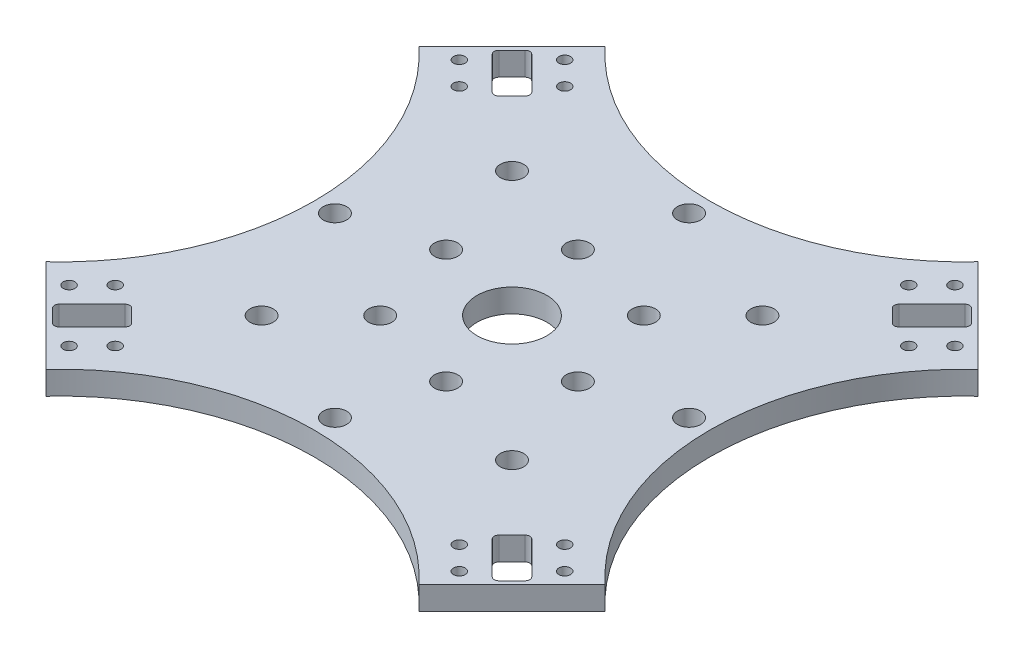
from build123d import *

# Parameters (mm, degrees)
BOSS_EXTRUDE1_DEPTH = 5
SKETCH7_R           = 1.25
CUT_EXTRUDE5_DEPTH  = 5
SKETCH9_R           = 7.5
SKETCH9_R_2         = 2.5
CUT_EXTRUDE11_DEPTH = 5


with BuildPart() as part:
    # Sketch3 → Boss-Extrude1 (new body)
    with BuildSketch(Plane(origin=(0, 0, 0), x_dir=(1, 0, 0), z_dir=(0, 1, 0))):
        with BuildLine():
            Line((-60, 40), (-40, 60))
            ThreePointArc((-40, 60), (0, 42.5), (40, 60))
            Line((40, 60), (60, 40))
            ThreePointArc((60, 40), (42.5, 0), (60, -40))
            Line((60, -40), (40, -60))
            ThreePointArc((40, -60), (0, -42.5), (-40, -60))
            Line((-40, -60), (-60, -40))
            ThreePointArc((-60, -40), (-42.5, 0), (-60, 40))
        make_face()
    extrude(amount=BOSS_EXTRUDE1_DEPTH)

    # Sketch7 → Cut-Extrude5 (cut)
    with BuildSketch(Plane(origin=(0, 5, 0), x_dir=(1, 0, 0), z_dir=(0, 1, 0))):
        with BuildLine():
            Line((-47.878679656, 50.707106781), (-49.292893219, 49.292893219))
            Line((-49.292893219, 49.292893219), (-40.807611845, 40.807611845))
            Line((-40.807611845, 40.807611845), (-39.393398282, 42.221825407))
            ThreePointArc((-39.393398282, 42.221825407), (-39.100505063, 42.928932188), (-39.393398282, 43.636038969))
            Line((-39.393398282, 43.636038969), (-46.464466094, 50.707106781))
            ThreePointArc((-46.464466094, 50.707106781), (-47.171572875, 51), (-47.878679656, 50.707106781))
        make_face()
        with BuildLine():
            Line((-40.807611845, 40.807611845), (-49.292893219, 49.292893219))
            Line((-49.292893219, 49.292893219), (-50.707106781, 47.878679656))
            ThreePointArc((-50.707106781, 47.878679656), (-51, 47.171572875), (-50.707106781, 46.464466094))
            Line((-50.707106781, 46.464466094), (-43.636038969, 39.393398282))
            ThreePointArc((-43.636038969, 39.393398282), (-42.928932188, 39.100505063), (-42.221825407, 39.393398282))
            Line((-42.221825407, 39.393398282), (-40.807611845, 40.807611845))
        make_face()
        with Locations(Location((-53.181980515, 41.868272016, 0), (0, 0, 270))):
            Circle(SKETCH7_R)
        with Locations(Location((-48.232233047, 36.918524548, 0), (0, 0, 270))):
            Circle(SKETCH7_R)
        with Locations(Location((-41.868272016, 53.181980515, 0), (0, 0, 270))):
            Circle(SKETCH7_R)
        with Locations(Location((-36.918524548, 48.232233047, 0), (0, 0, 270))):
            Circle(SKETCH7_R)
        with BuildLine():
            Line((-39.393398282, -42.221825407), (-40.807611845, -40.807611845))
            Line((-40.807611845, -40.807611845), (-49.292893219, -49.292893219))
            Line((-49.292893219, -49.292893219), (-47.878679656, -50.707106781))
            ThreePointArc((-47.878679656, -50.707106781), (-47.171572875, -51), (-46.464466094, -50.707106781))
            Line((-46.464466094, -50.707106781), (-39.393398282, -43.636038969))
            ThreePointArc((-39.393398282, -43.636038969), (-39.100505063, -42.928932188), (-39.393398282, -42.221825407))
        make_face()
        with BuildLine():
            Line((-49.292893219, -49.292893219), (-40.807611845, -40.807611845))
            Line((-40.807611845, -40.807611845), (-42.221825407, -39.393398282))
            ThreePointArc((-42.221825407, -39.393398282), (-42.928932188, -39.100505063), (-43.636038969, -39.393398282))
            Line((-43.636038969, -39.393398282), (-50.707106781, -46.464466094))
            ThreePointArc((-50.707106781, -46.464466094), (-51, -47.171572875), (-50.707106781, -47.878679656))
            Line((-50.707106781, -47.878679656), (-49.292893219, -49.292893219))
        make_face()
        with Locations(Location((-53.181980515, -41.868272016, 0), (0, 0, 270))):
            Circle(SKETCH7_R)
        with Locations(Location((-48.232233047, -36.918524548, 0), (0, 0, 270))):
            Circle(SKETCH7_R)
        with Locations(Location((-41.868272016, -53.181980515, 0), (0, 0, 270))):
            Circle(SKETCH7_R)
        with BuildLine():
            Line((49.292893219, -49.292893219), (40.807611845, -40.807611845))
            Line((40.807611845, -40.807611845), (39.393398282, -42.221825407))
            ThreePointArc((39.393398282, -42.221825407), (39.100505063, -42.928932188), (39.393398282, -43.636038969))
            Line((39.393398282, -43.636038969), (46.464466094, -50.707106781))
            ThreePointArc((46.464466094, -50.707106781), (47.171572875, -51), (47.878679656, -50.707106781))
            Line((47.878679656, -50.707106781), (49.292893219, -49.292893219))
        make_face()
        with BuildLine():
            Line((42.221825407, -39.393398282), (40.807611845, -40.807611845))
            Line((40.807611845, -40.807611845), (49.292893219, -49.292893219))
            Line((49.292893219, -49.292893219), (50.707106781, -47.878679656))
            ThreePointArc((50.707106781, -47.878679656), (51, -47.171572875), (50.707106781, -46.464466094))
            Line((50.707106781, -46.464466094), (43.636038969, -39.393398282))
            ThreePointArc((43.636038969, -39.393398282), (42.928932188, -39.100505063), (42.221825407, -39.393398282))
        make_face()
        with Locations(Location((53.181980515, -41.868272016, 0), (0, 0, 270))):
            Circle(SKETCH7_R)
        with BuildLine():
            Line((39.393398282, 42.221825407), (40.807611845, 40.807611845))
            Line((40.807611845, 40.807611845), (49.292893219, 49.292893219))
            Line((49.292893219, 49.292893219), (47.878679656, 50.707106781))
            ThreePointArc((47.878679656, 50.707106781), (47.171572875, 51), (46.464466094, 50.707106781))
            Line((46.464466094, 50.707106781), (39.393398282, 43.636038969))
            ThreePointArc((39.393398282, 43.636038969), (39.100505063, 42.928932188), (39.393398282, 42.221825407))
        make_face()
        with BuildLine():
            Line((49.292893219, 49.292893219), (40.807611845, 40.807611845))
            Line((40.807611845, 40.807611845), (42.221825407, 39.393398282))
            ThreePointArc((42.221825407, 39.393398282), (42.928932188, 39.100505063), (43.636038969, 39.393398282))
            Line((43.636038969, 39.393398282), (50.707106781, 46.464466094))
            ThreePointArc((50.707106781, 46.464466094), (51, 47.171572875), (50.707106781, 47.878679656))
            Line((50.707106781, 47.878679656), (49.292893219, 49.292893219))
        make_face()
        with Locations(Location((41.868272016, 53.181980515, 0), (0, 0, 270))):
            Circle(SKETCH7_R)
        with Locations(Location((36.918524548, 48.232233047, 0), (0, 0, 270))):
            Circle(SKETCH7_R)
        with Locations(Location((53.181980515, 41.868272016, 0), (0, 0, 270))):
            Circle(SKETCH7_R)
        with Locations(Location((48.232233047, 36.918524548, 0), (0, 0, 270))):
            Circle(SKETCH7_R)
        with Locations(Location((-36.918524548, -48.232233047, 0), (0, 0, 90))):
            Circle(SKETCH7_R)
        with Locations(Location((48.232233047, -36.918524548, 0), (0, 0, 90))):
            Circle(SKETCH7_R)
        with Locations(Location((41.868272016, -53.181980515, 0), (0, 0, 270))):
            Circle(SKETCH7_R)
        with Locations(Location((36.918524548, -48.232233047, 0), (0, 0, 270))):
            Circle(SKETCH7_R)
    extrude(amount=-CUT_EXTRUDE5_DEPTH, mode=Mode.SUBTRACT)

    # Sketch9 → Cut-Extrude11 (cut)
    with BuildSketch(Plane(origin=(0, 5, 0), x_dir=(1, 0, 0), z_dir=(0, 1, 0))):
        with Locations(Location((0, 0, 0), (0, 0, 270))):
            Circle(SKETCH9_R)
        with Locations(Location((26.870057685, 26.870057685, 0), (0, 0, 270))):
            Circle(SKETCH9_R_2)
        with Locations(Location((38, 0, 0), (0, 0, 270))):
            Circle(SKETCH9_R_2)
        with Locations(Location((26.870057685, -26.870057685, 0), (0, 0, 270))):
            Circle(SKETCH9_R_2)
        with Locations(Location((0, -38, 0), (0, 0, 270))):
            Circle(SKETCH9_R_2)
        with Locations(Location((-26.870057685, -26.870057685, 0), (0, 0, 270))):
            Circle(SKETCH9_R_2)
        with Locations(Location((-38, 0, 0), (0, 0, 270))):
            Circle(SKETCH9_R_2)
        with Locations(Location((-26.870057685, 26.870057685, 0), (0, 0, 270))):
            Circle(SKETCH9_R_2)
        with Locations(Location((0, 38, 0), (0, 0, 270))):
            Circle(SKETCH9_R_2)
        with Locations(Location((14.142135624, 14.142135624, 0), (0, 0, 270))):
            Circle(SKETCH9_R_2)
        with Locations(Location((19.318516526, -5.176380902, 0), (0, 0, 270))):
            Circle(SKETCH9_R_2)
        with Locations(Location((5.176380902, -19.318516526, 0), (0, 0, 270))):
            Circle(SKETCH9_R_2)
        with Locations(Location((-14.142135624, -14.142135624, 0), (0, 0, 270))):
            Circle(SKETCH9_R_2)
        with Locations(Location((-19.318516526, 5.176380902, 0), (0, 0, 270))):
            Circle(SKETCH9_R_2)
        with Locations(Location((-5.176380902, 19.318516526, 0), (0, 0, 270))):
            Circle(SKETCH9_R_2)
    extrude(amount=-CUT_EXTRUDE11_DEPTH, mode=Mode.SUBTRACT)


solid = part.part
